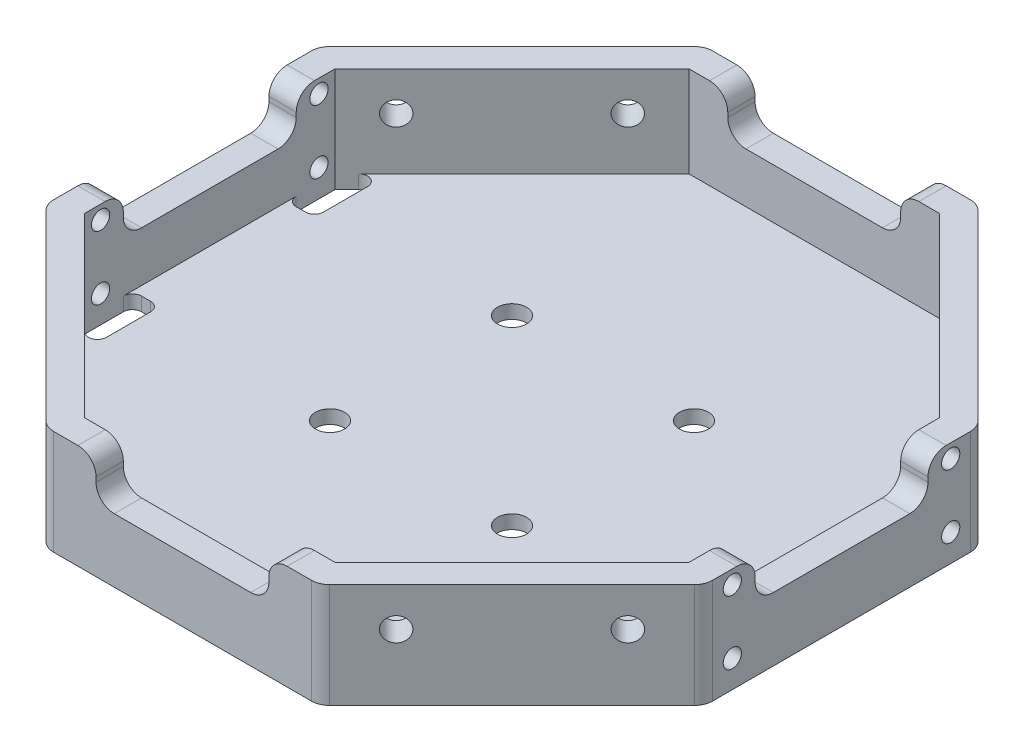
from build123d import *

# Parameters (mm, degrees)
BOSS_EXTRUDE1_DEPTH = 11.5
SHELL1_T            = -3
SKETCH3_R           = 1.3
CUT_EXTRUDE1_DEPTH  = 94
SKETCH4_R           = 1.3
CUT_EXTRUDE2_DEPTH  = 94
FILLET1_R           = 2
CUT_EXTRUDE3_DEPTH  = 79
CUT_EXTRUDE4_DEPTH  = 79
FILLET2_R           = 2
SKETCH7_R           = 1.6
CUT_EXTRUDE5_DEPTH  = 10
SKETCH8_R           = 1
CUT_EXTRUDE7_DEPTH  = 79
CUT_EXTRUDE8_DEPTH  = 1.5
CUT_EXTRUDE9_DEPTH  = 1.5
FILLET3_R           = 1


with BuildPart() as part:
    # Sketch1 → Boss-Extrude1 (new body)
    with BuildSketch(Plane(origin=(0, 0, 0), x_dir=(1, 0, 0), z_dir=(0, 1, 0))):
        Polygon((-11.213203436, 40), (18.786796564, 40), (40, 18.786796564), (40, -11.213203436), (18.786796564, -32.426406871), (-11.213203436, -32.426406871), (-32.426406871, -11.213203436), (-32.426406871, 18.786796564), align=None)
    extrude(amount=BOSS_EXTRUDE1_DEPTH)

    # Shell1
    shell1_openings = [part.faces().sort_by_distance(p)[0] for p in [
        (3.786796564, 11.5, -3.786796564),
    ]]
    offset(amount=SHELL1_T, openings=shell1_openings, kind=Kind.INTERSECTION)

    # Sketch3 → Cut-Extrude1 (cut)
    with BuildSketch(Plane(origin=(-21.819805153, 0, 21.819805153), x_dir=(0.7071067811865558, 0, 0.7071067811865392), z_dir=(-0.7071067811865392, 0, 0.7071067811865558))):
        with Locations((-9, 7.25)):
            Circle(SKETCH3_R)
        with Locations((9, 7.25)):
            Circle(SKETCH3_R)
    extrude(amount=-CUT_EXTRUDE1_DEPTH, mode=Mode.SUBTRACT)

    # Sketch4 → Cut-Extrude2 (cut)
    with BuildSketch(Plane(origin=(-25.606601718, 0, -25.606601718), x_dir=(-0.7071067811865556, 0, 0.7071067811865396), z_dir=(-0.7071067811865396, 0, -0.7071067811865556))):
        with Locations((-14.355339059, 7.25)):
            Circle(SKETCH4_R)
        with Locations((3.644660941, 7.25)):
            Circle(SKETCH4_R)
    extrude(amount=-CUT_EXTRUDE2_DEPTH, mode=Mode.SUBTRACT)

    # Fillet1
    fillet1_edges = [part.edges().sort_by_distance(p)[0] for p in [
        (40, 5.75, -18.786796564),
        (40, 5.75, 11.213203436),
        (18.786796564, 5.75, 32.426406871),
        (-11.213203436, 5.75, 32.426406871),
        (-32.426406871, 5.75, 11.213203436),
        (-32.426406871, 5.75, -18.786796564),
        (-11.213203436, 5.75, -40),
        (18.786796564, 5.75, -40),
    ]]
    fillet(fillet1_edges, radius=FILLET1_R)

    # Sketch5 → Cut-Extrude3 (cut)
    with BuildSketch(Plane.XY.offset(32.426406871)):
        Polygon((3.786796564, 7), (13.286796564, 7), (13.286796564, 11.5), (-5.713203436, 11.5), (-5.713203436, 7), align=None)
    extrude(amount=-CUT_EXTRUDE3_DEPTH, mode=Mode.SUBTRACT)

    # Sketch6 → Cut-Extrude4 (cut)
    with BuildSketch(Plane.ZY.offset(32.426406871)):
        Polygon((-3.786796564, 7), (5.713203436, 7), (5.713203436, 11.5), (-13.286796564, 11.5), (-13.286796564, 7), align=None)
    extrude(amount=-CUT_EXTRUDE4_DEPTH, mode=Mode.SUBTRACT)

    # Fillet2
    fillet2_edges = [part.edges().sort_by_distance(p)[0] for p in [
        (-5.713203436, 7, -38.5),
        (-5.713203436, 11.5, -38.5),
        (13.286796564, 11.5, -38.5),
        (13.286796564, 7, -38.5),
        (-5.713203436, 7, 30.926406871),
        (-5.713203436, 11.5, 30.926406871),
        (13.286796564, 11.5, 30.926406871),
        (13.286796564, 7, 30.926406871),
        (38.5, 7, -13.286796564),
        (-30.926406871, 7, -13.286796564),
        (38.5, 11.5, -13.286796564),
        (-30.926406871, 11.5, -13.286796564),
        (38.5, 11.5, 5.713203436),
        (-30.926406871, 11.5, 5.713203436),
        (38.5, 7, 5.713203436),
        (-30.926406871, 7, 5.713203436),
    ]]
    fillet(fillet2_edges, radius=FILLET2_R)

    # Sketch7 → Cut-Extrude5 (cut)
    with BuildSketch(Plane(origin=(0, 0, 0), x_dir=(-1, 0, 0), z_dir=(0, -1, 0))):
        with Locations(Location((6.213203436, -6.213203436, 0), (0, 0, 90))):
            Circle(SKETCH7_R)
        with Locations(Location((-13.786796564, -6.213203436, 0), (0, 0, 90))):
            Circle(SKETCH7_R)
        with Locations(Location((-13.786796564, 13.786796564, 0), (0, 0, 90))):
            Circle(SKETCH7_R)
        with Locations(Location((6.213203436, 13.786796564, 0), (0, 0, 90))):
            Circle(SKETCH7_R)
    extrude(amount=-CUT_EXTRUDE5_DEPTH, mode=Mode.SUBTRACT)

    # Sketch8 → Cut-Extrude7 (cut)
    with BuildSketch(Plane(origin=(40, 0, 0), x_dir=(0, 0, -1), z_dir=(1, 0, 0))):
        with Locations((-8.213203436, 10)):
            Circle(SKETCH8_R)
        with Locations((-8.213203436, 3)):
            Circle(SKETCH8_R)
        with Locations((15.786796564, 3)):
            Circle(SKETCH8_R)
        with Locations(Location((15.786796564, 10, 0), (0, 0, 180))):
            Circle(SKETCH8_R)
    extrude(amount=-CUT_EXTRUDE7_DEPTH, mode=Mode.SUBTRACT)

    # Sketch10 → Cut-Extrude8 (cut)
    with BuildSketch(Plane(origin=(0, 3, 0), x_dir=(1, 0, 0), z_dir=(0, 1, 0))):
        Polygon((17.544155877, 37), (37, 17.544155877), (37, -9.970562748), (17.544155877, -29.426406871), (-9.970562748, -29.426406871), (-29.426406871, -9.970562748), (-29.426406871, 17.544155877), (-9.970562748, 37), align=None)
    extrude(amount=-CUT_EXTRUDE8_DEPTH, mode=Mode.SUBTRACT)

    # Sketch12 → Cut-Extrude9 (cut)
    with BuildSketch(Plane(origin=(0, 1.5, 0), x_dir=(1, 0, 0), z_dir=(0, 1, 0))):
        Polygon((-26.426406871, 20.544155877), (-29.426406871, 17.544155877), (-29.426406871, 12.286796564), (-26.426406871, 12.286796564), align=None)
        Polygon((-26.426406871, -4.713203436), (-29.426406871, -4.713203436), (-29.426406871, -9.970562748), (-26.426406871, -12.970562748), align=None)
        Polygon((34, 12.286796564), (37, 12.286796564), (37, 17.544155877), (34, 20.544155877), align=None)
        Polygon((37, -9.970562748), (37, -4.713203436), (34, -4.713203436), (34, -12.970562748), align=None)
    extrude(amount=-CUT_EXTRUDE9_DEPTH, mode=Mode.SUBTRACT)

    # Fillet3
    fillet3_edges = [part.edges().sort_by_distance(p)[0] for p in [
        (-26.426406871, 0.75, 4.713203436),
        (-26.426406871, 0.75, 12.970562748),
        (-29.426406871, 0.75, 4.713203436),
        (34, 0.75, -12.286796564),
        (34, 0.75, -20.544155877),
        (37, 0.75, -12.286796564),
        (37, 0.75, 4.713203436),
        (34, 0.75, 12.970562748),
        (34, 0.75, 4.713203436),
        (-29.426406871, 0.75, -12.286796564),
        (-26.426406871, 0.75, -20.544155877),
        (-26.426406871, 0.75, -12.286796564),
    ]]
    fillet(fillet3_edges, radius=FILLET3_R)


solid = part.part
